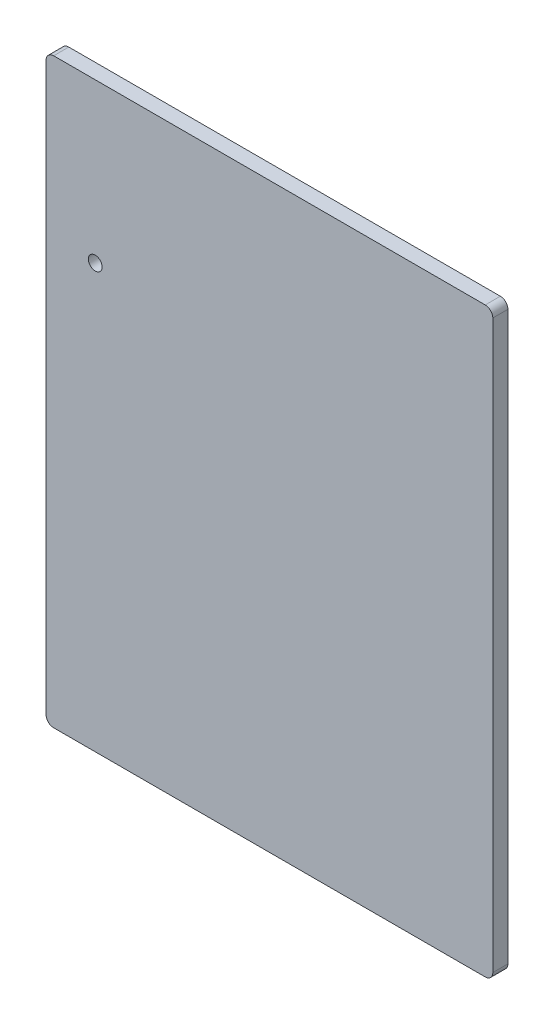
from build123d import *

# Parameters (mm, degrees)
SKETCH_1_W               = 591
SKETCH_1_H               = 770
EXTRUDE_1_DEPTH          = 20
CUT_EXTRUDE_1_DEPTH      = 825.997121207
CUT_EXTRUDE_1_DEPTH_BACK = 825.997121207
SKETCH_2_R               = 9.1
FILLET_1_R               = 10
SKETCH_4_R               = 20.1
CUT_EXTRUDE_3_DEPTH      = 15
SKETCH_5_W               = 431
SKETCH_5_H               = 710
CUT_EXTRUDE_4_DEPTH      = 5
FILLET_2_R               = 16


with BuildPart() as part:
    # 草图1 → 凸台-拉伸1 (new body)
    with BuildSketch(Plane.XY):
        with Locations((0, 385)):
            Rectangle(SKETCH_1_W, SKETCH_1_H)
    extrude(amount=EXTRUDE_1_DEPTH)

    # 草图2 → 切除-拉伸1 (cut, two sides: drawn at the far end of the back side and taken through both)
    with BuildSketch(Plane.XY.offset(20).offset(-CUT_EXTRUDE_1_DEPTH_BACK)):
        with Locations((-230.5, 560)):
            Circle(SKETCH_2_R)
    extrude(amount=CUT_EXTRUDE_1_DEPTH + CUT_EXTRUDE_1_DEPTH_BACK, mode=Mode.SUBTRACT)

    # 圆角1
    fillet_1_edges = [part.edges().sort_by_distance(p)[0] for p in [
        (-295.5, 770, 10),
        (295.5, 770, 10),
        (295.5, 0, 10),
        (-295.5, 0, 10),
    ]]
    fillet(fillet_1_edges, radius=FILLET_1_R)

    # 草图4 → 切除-拉伸3 (cut)
    with BuildSketch(Plane(origin=(0, 0, 0), x_dir=(-1, 0, 0), z_dir=(0, 0, -1))):
        with Locations((-265.5, 700)):
            Circle(SKETCH_4_R)
        with Locations((-265.5, 310)):
            Circle(SKETCH_4_R)
        with Locations((-265.5, 100)):
            Circle(SKETCH_4_R)
    extrude(amount=-CUT_EXTRUDE_3_DEPTH, mode=Mode.SUBTRACT)

    # 草图5 → 切除-拉伸4 (cut)
    with BuildSketch(Plane(origin=(0, 0, 0), x_dir=(-1, 0, 0), z_dir=(0, 0, -1))):
        with Locations((0, 385)):
            Rectangle(SKETCH_5_W, SKETCH_5_H)
    extrude(amount=-CUT_EXTRUDE_4_DEPTH, mode=Mode.SUBTRACT)

    # 圆角2
    fillet_2_edges = [part.edges().sort_by_distance(p)[0] for p in [
        (215.5, 30, 2.5),
        (215.5, 740, 2.5),
        (-215.5, 740, 2.5),
        (-215.5, 30, 2.5),
    ]]
    fillet(fillet_2_edges, radius=FILLET_2_R)


solid = part.part
